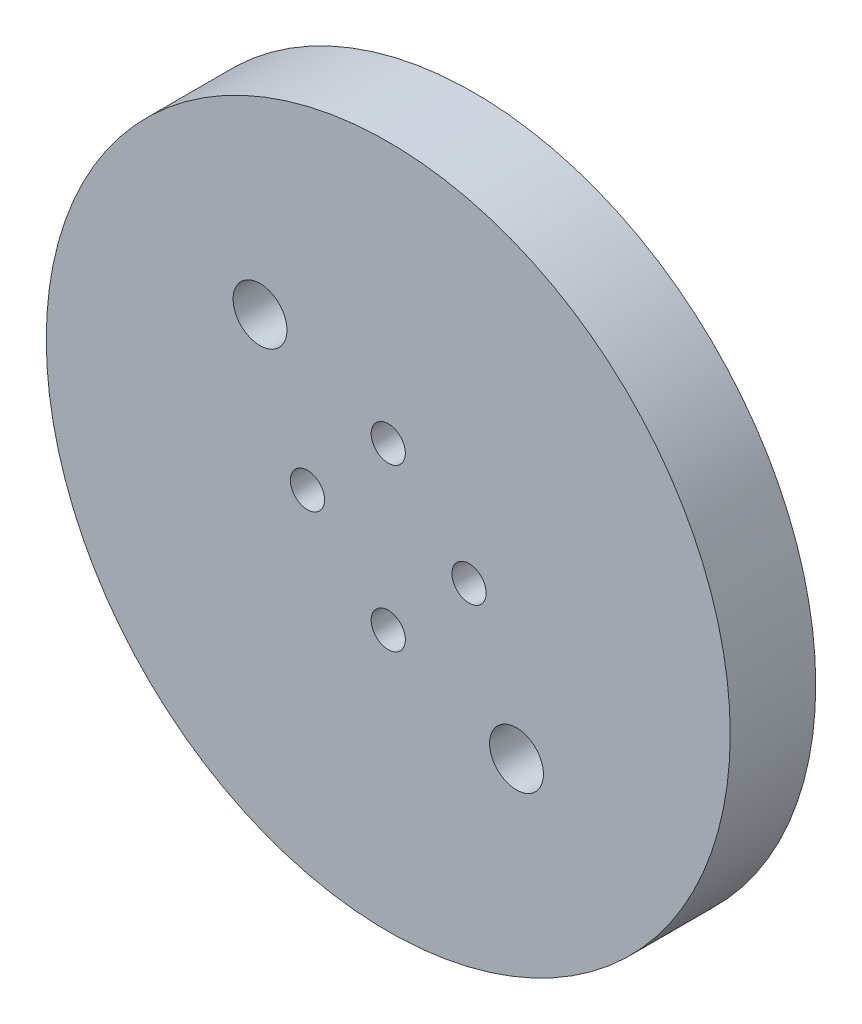
from build123d import *

# Parameters (mm, degrees)
SKETCH1_R           = 50.8
SKETCH1_R_2         = 2.54
BOSS_EXTRUDE1_DEPTH = 12.7
SKETCH2_R           = 4
CUT_EXTRUDE1_DEPTH  = 73.955945611
SKETCH3_R           = 12.7
CUT_EXTRUDE2_DEPTH  = 6.35
SKETCH4_R           = 4
CUT_EXTRUDE3_DEPTH  = 73.955945611
SKETCH5_R           = 12.7
CUT_EXTRUDE5_DEPTH  = 6.35


with BuildPart() as part:
    # Sketch1 → Boss-Extrude1 (new body)
    with BuildSketch(Plane.XY):
        Circle(SKETCH1_R)
        with Locations((12, 0)):
            Circle(SKETCH1_R_2, mode=Mode.SUBTRACT)
        with Locations((0, -12)):
            Circle(SKETCH1_R_2, mode=Mode.SUBTRACT)
        with Locations((-12, 0)):
            Circle(SKETCH1_R_2, mode=Mode.SUBTRACT)
        with Locations((0, 12)):
            Circle(SKETCH1_R_2, mode=Mode.SUBTRACT)
    extrude(amount=BOSS_EXTRUDE1_DEPTH)

    # Sketch2 → Cut-Extrude1 (cut, through all)
    with BuildSketch(Plane.XY):
        with Locations((19.05, -19.05)):
            Circle(SKETCH2_R)
    extrude(amount=CUT_EXTRUDE1_DEPTH, mode=Mode.SUBTRACT)

    # Sketch3 → Cut-Extrude2 (cut)
    with BuildSketch(Plane.XY):
        with Locations((19.05, -19.05)):
            Circle(SKETCH3_R)
    extrude(amount=CUT_EXTRUDE2_DEPTH, mode=Mode.SUBTRACT)

    # Sketch4 → Cut-Extrude3 (cut, through all)
    with BuildSketch(Plane.XY):
        with Locations((-19.05, 19.05)):
            Circle(SKETCH4_R)
    extrude(amount=CUT_EXTRUDE3_DEPTH, mode=Mode.SUBTRACT)

    # Sketch5 → Cut-Extrude5 (cut)
    with BuildSketch(Plane.XY):
        with Locations((-19.05, 19.05)):
            Circle(SKETCH5_R)
    extrude(amount=CUT_EXTRUDE5_DEPTH, mode=Mode.SUBTRACT)


solid = part.part
